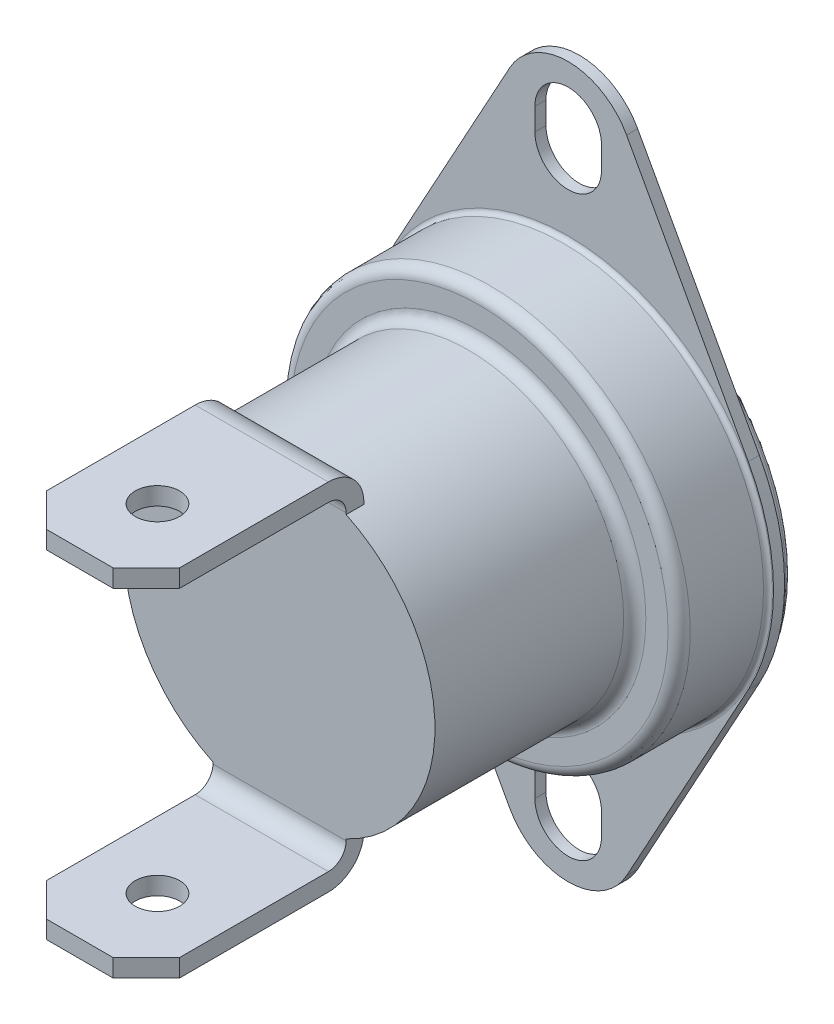
from build123d import *

# Parameters (mm, degrees)
EXTRUDE_1_DEPTH      = 0.5
EXTRUDE_2_DEPTH      = 4
EXTRUDE_2_DEPTH_BACK = 1
SKETCH_2_R           = 9
SKETCH_3_R           = 7
EXTRUDE_3_DEPTH      = 9
FILLET_1_R           = 0.2
FILLET_2_R           = 0.5
EXTRUDE_4_DEPTH      = 3
EXTRUDE_4_DEPTH_BACK = 3
SKETCH_5_R           = 1
CUT_EXTRUDE_1_DEPTH  = 20
CHAMFER_1_SIZE       = 1.5


with BuildPart() as part:
    # Эскиз1 → Вытянуть1 (new body)
    with BuildSketch(Plane.XY):
        with BuildLine():
            Line((-2.630541488, 14.442307692), (-8.110836255, 4.447115385))
            ThreePointArc((-8.110836255, 4.447115385), (-9.25, 0), (-8.110836255, -4.447115385))
            Line((-8.110836255, -4.447115385), (-2.630541488, -14.442307692))
            ThreePointArc((-2.630541488, -14.442307692), (0, -16), (2.630541488, -14.442307692))
            Line((2.630541488, -14.442307692), (8.110836255, -4.447115385))
            ThreePointArc((8.110836255, -4.447115385), (9.25, 0), (8.110836255, 4.447115385))
            Line((8.110836255, 4.447115385), (2.630541488, 14.442307692))
            ThreePointArc((2.630541488, 14.442307692), (0, 16), (-2.630541488, 14.442307692))
        make_face()
        with BuildLine():
            Line((1.5, 12.5), (1.5, 13.5))
            ThreePointArc((1.5, 13.5), (0, 15), (-1.5, 13.5))
            Line((-1.5, 13.5), (-1.5, 12.5))
            ThreePointArc((-1.5, 12.5), (0, 11), (1.5, 12.5))
        make_face(mode=Mode.SUBTRACT)
        with BuildLine():
            Line((1.5, -12.5), (1.5, -13.5))
            ThreePointArc((1.5, -13.5), (0, -15), (-1.5, -13.5))
            Line((-1.5, -13.5), (-1.5, -12.5))
            ThreePointArc((-1.5, -12.5), (0, -11), (1.5, -12.5))
        make_face(mode=Mode.SUBTRACT)
    extrude(amount=EXTRUDE_1_DEPTH)

    # Эскиз2 → Вытянуть2 (add, two sides: drawn at the far end of the back side and taken through both)
    with BuildSketch(Plane.XY.offset(0.5).offset(-EXTRUDE_2_DEPTH_BACK)):
        Circle(SKETCH_2_R)
    extrude(amount=EXTRUDE_2_DEPTH + EXTRUDE_2_DEPTH_BACK)

    # Эскиз3 → Вытянуть3 (add)
    with BuildSketch(Plane.XY.offset(4.5)):
        Circle(SKETCH_3_R)
    extrude(amount=EXTRUDE_3_DEPTH)

    # Скругление1
    fillet_1_edges = [part.edges().sort_by_distance(p)[0] for p in [
        (-9, 0, 0.5),
        (-9, 0, -0.5),
    ]]
    fillet(fillet_1_edges, radius=FILLET_1_R)

    # Скругление2
    fillet_2_edges = [part.edges().sort_by_distance(p)[0] for p in [
        (-9, 0, 4.5),
        (-7, 0, 4.5),
    ]]
    fillet(fillet_2_edges, radius=FILLET_2_R)

    # Эскиз4 → Вытянуть4 (add, two sides: drawn at the far end of the back side and taken through both)
    with BuildSketch(Plane(origin=(0, 0, 0), x_dir=(0, 0, -1), z_dir=(1, 0, 0)).offset(-EXTRUDE_4_DEPTH_BACK)):
        with BuildLine():
            Line((-22.5, 7.2), (-14.3, 7.2))
            ThreePointArc((-14.3, 7.2), (-13.734314575, 6.965685425), (-13.5, 6.4))
            Line((-13.5, 6.4), (-13.5, 5.184112681))
            Line((-13.5, 5.184112681), (-12.7, 5.184112681))
            Line((-12.7, 5.184112681), (-12.7, 6.4))
            ThreePointArc((-12.7, 6.4), (-13.16862915, 7.53137085), (-14.3, 8))
            Line((-14.3, 8), (-22.5, 8))
            Line((-22.5, 8), (-22.5, 7.2))
        make_face()
        with BuildLine():
            Line((-13.5, -5.184112681), (-13.5, -6.4))
            ThreePointArc((-13.5, -6.4), (-13.734314575, -6.965685425), (-14.3, -7.2))
            Line((-14.3, -7.2), (-22.5, -7.2))
            Line((-22.5, -7.2), (-22.5, -8))
            Line((-22.5, -8), (-14.3, -8))
            ThreePointArc((-14.3, -8), (-13.16862915, -7.53137085), (-12.7, -6.4))
            Line((-12.7, -6.4), (-12.7, -5.184112681))
            Line((-12.7, -5.184112681), (-13.5, -5.184112681))
        make_face()
    extrude(amount=EXTRUDE_4_DEPTH + EXTRUDE_4_DEPTH_BACK)

    # Эскиз5 → Вырез-Вытянуть1 (cut)
    with BuildSketch(Plane.XZ.offset(8)):
        with Locations(Location((0, 19, 0), (0, 0, 270))):
            Circle(SKETCH_5_R)
    extrude(amount=-CUT_EXTRUDE_1_DEPTH, mode=Mode.SUBTRACT)

    # Фаска1
    chamfer_1_edges = [part.edges().sort_by_distance(p)[0] for p in [
        (3, -7.6, 22.5),
        (-3, -7.6, 22.5),
        (3, 7.6, 22.5),
        (-3, 7.6, 22.5),
    ]]
    chamfer(chamfer_1_edges, length=CHAMFER_1_SIZE)


solid = part.part
